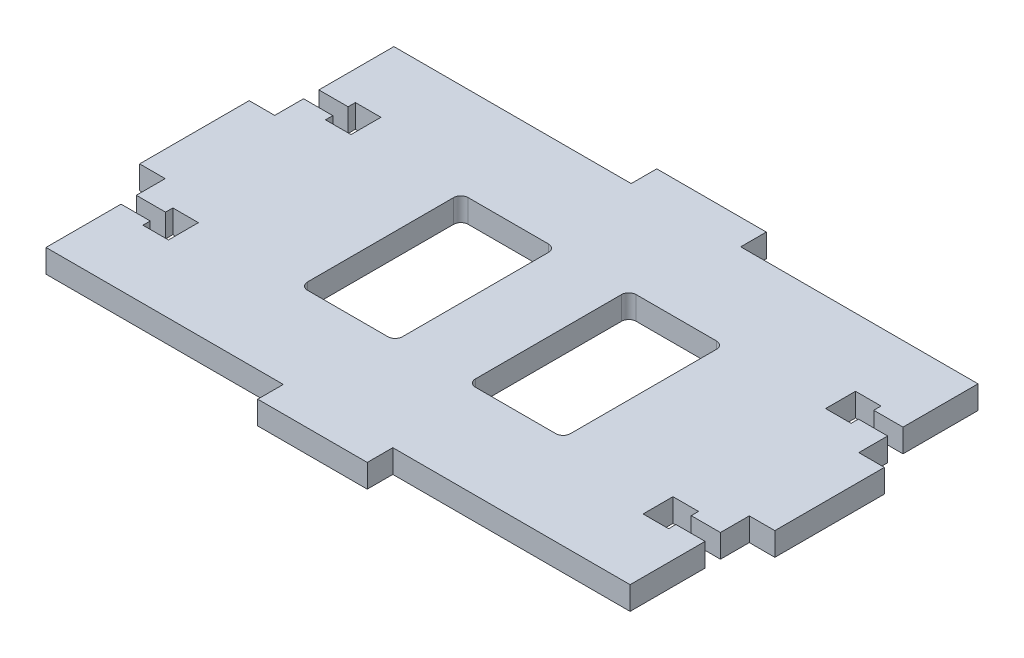
from build123d import *

# Parameters (mm, degrees)
SKETCH2_W               = 80
SKETCH2_H               = 47.65
BOSS_EXTRUDE1_DEPTH     = 3.175
SKETCH3_W               = 15
SKETCH3_H               = 3.5
BOSS_EXTRUDE2_DEPTH     = 3.175
SKETCH4_W               = 3.5
SKETCH4_H               = 15
BOSS_EXTRUDE3_DEPTH     = 3.175
MIRROR2_COPY_1_SKETCH_W = 3.5
MIRROR2_COPY_1_SKETCH_H = 15
MIRROR2_COPY_1_DEPTH    = 3.175
MIRROR2_COPY_2_SKETCH_W = 3.5
MIRROR2_COPY_2_SKETCH_H = 15
MIRROR2_COPY_2_DEPTH    = 3.175
CUT_EXTRUDE1_DEPTH      = 10
MIRROR4_COPY_1_DEPTH    = 10
SKETCH6_W               = 13
SKETCH6_H               = 22
CUT_EXTRUDE2_DEPTH      = 52.468303353
FILLET1_R               = 1
FILLET1_OF_MIRROR5_R    = 1


with BuildPart() as part:
    # Sketch2 → Boss-Extrude1 (new body)
    with BuildSketch(Plane(origin=(0, 0, 0), x_dir=(1, 0, 0), z_dir=(0, 1, 0))):
        Rectangle(SKETCH2_W, SKETCH2_H)
    extrude(amount=BOSS_EXTRUDE1_DEPTH)

    # Sketch3 → Boss-Extrude2 (add)
    with BuildSketch(Plane(origin=(0, 3.175, 0), x_dir=(1, 0, 0), z_dir=(0, 1, 0))):
        with Locations((0, 25.575)):
            Rectangle(SKETCH3_W, SKETCH3_H)
    boss_extrude2 = extrude(amount=-BOSS_EXTRUDE2_DEPTH)

    # Sketch4 → Boss-Extrude3 (add)
    with BuildSketch(Plane(origin=(0, 3.175, 0), x_dir=(1, 0, 0), z_dir=(0, 1, 0))):
        with Locations((-41.75, 0)):
            Rectangle(SKETCH4_W, SKETCH4_H)
    boss_extrude3 = extrude(amount=-BOSS_EXTRUDE3_DEPTH)

    # Mirror1: Boss-Extrude3 across plane
    add(boss_extrude3.mirror(Plane(origin=(0, 0, 0), x_dir=(0, 0, 1), z_dir=(1, 0, 0))))

    # Mirror2: Boss-Extrude2 across plane
    add(boss_extrude2.mirror(Plane.XY))

    # Mirror2 copy 1 sketch → Mirror2 copy 1 (add)
    with BuildSketch(Plane(origin=(0, 3.175, 0), x_dir=(-1, 0, 0), z_dir=(0, 1, 0))):
        with Locations((-41.75, 0)):
            Rectangle(MIRROR2_COPY_1_SKETCH_W, MIRROR2_COPY_1_SKETCH_H)
    extrude(amount=-MIRROR2_COPY_1_DEPTH)

    # Mirror2 copy 2 sketch → Mirror2 copy 2 (add)
    with BuildSketch(Plane(origin=(0, 3.175, 0), x_dir=(1, 0, 0), z_dir=(0, 1, 0))):
        with Locations((-41.75, 0)):
            Rectangle(MIRROR2_COPY_2_SKETCH_W, MIRROR2_COPY_2_SKETCH_H)
    extrude(amount=-MIRROR2_COPY_2_DEPTH)

    # Sketch5 → Cut-Extrude1 (cut)
    with BuildSketch(Plane(origin=(0, 3.175, 0), x_dir=(1, 0, 0), z_dir=(0, 1, 0))):
        Polygon((-40, 13.55), (-36, 13.55), (-36, 14.55), (-32.5, 14.55), (-32.5, 10.45), (-36, 10.45), (-36, 11.45), (-40, 11.45), align=None)
    cut_extrude1 = extrude(amount=-CUT_EXTRUDE1_DEPTH, mode=Mode.SUBTRACT)

    # Mirror3: Cut-Extrude1 across plane
    add(cut_extrude1.mirror(Plane.XY), mode=Mode.SUBTRACT)

    # Mirror4: Cut-Extrude1 across plane
    add(cut_extrude1.mirror(Plane(origin=(0, 0, 0), x_dir=(0, 0, 1), z_dir=(1, 0, 0))), mode=Mode.SUBTRACT)

    # Mirror4 copy 1 sketch → Mirror4 copy 1 (cut)
    with BuildSketch(Plane(origin=(0, 3.175, 0), x_dir=(-1, 0, 0), z_dir=(0, 1, 0))):
        Polygon((-40, 13.55), (-36, 13.55), (-36, 14.55), (-32.5, 14.55), (-32.5, 10.45), (-36, 10.45), (-36, 11.45), (-40, 11.45), align=None)
    extrude(amount=-MIRROR4_COPY_1_DEPTH, mode=Mode.SUBTRACT)

    # Sketch6 → Cut-Extrude2 (cut, through all)
    with BuildSketch(Plane(origin=(0, 3.175, 0), x_dir=(1, 0, 0), z_dir=(0, 1, 0))):
        with Locations((11.5, 0)):
            Rectangle(SKETCH6_W, SKETCH6_H)
    cut_extrude2 = extrude(amount=-CUT_EXTRUDE2_DEPTH, mode=Mode.SUBTRACT)

    # Fillet1
    fillet1_edges = [part.edges().sort_by_distance(p)[0] for p in [
        (5, 1.5875, 11),
        (5, 1.5875, -11),
        (18, 1.5875, -11),
        (18, 1.5875, 11),
    ]]
    fillet(fillet1_edges, radius=FILLET1_R)

    # Mirror5: Cut-Extrude2 across plane
    add(cut_extrude2.mirror(Plane(origin=(0, 0, 0), x_dir=(0, 0, 1), z_dir=(1, 0, 0))), mode=Mode.SUBTRACT)

    # Fillet1 of Mirror5
    fillet1_of_mirror5_edges = [part.edges().sort_by_distance(p)[0] for p in [
        (-5, 1.5875, 11),
        (-5, 1.5875, -11),
        (-18, 1.5875, -11),
        (-18, 1.5875, 11),
    ]]
    fillet(fillet1_of_mirror5_edges, radius=FILLET1_OF_MIRROR5_R)


solid = part.part
